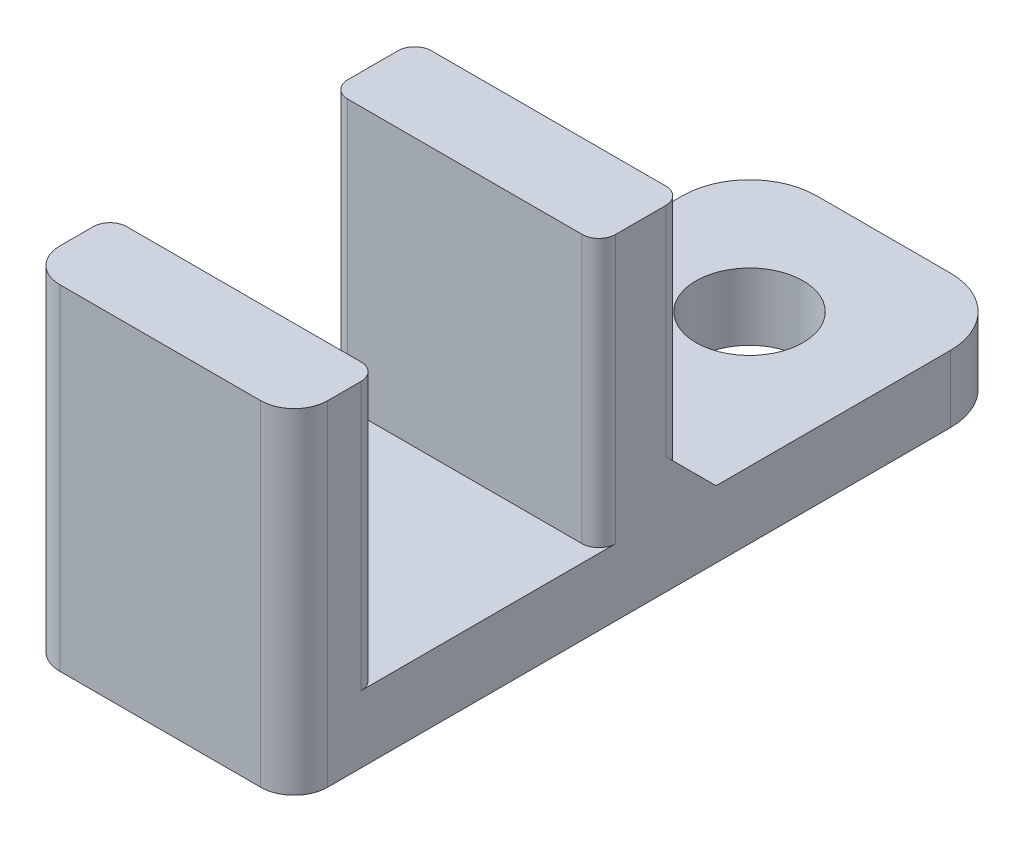
from build123d import *

# Parameters (mm, degrees)
ESBO_O1_W                = 8
ESBO_O1_H                = 21.6
RESSALTO_EXTRUS_O1_DEPTH = 2
ESBO_O2_W                = 8
ESBO_O2_H                = 2.5
RESSALTO_EXTRUS_O2_DEPTH = 8
ESBO_O3_R                = 1.6
CORTE_EXTRUS_O1_DEPTH    = 8
FILETE1_R                = 2
FILETE2_R                = 2
FILETE3_R                = 1
FILETE4_R                = 1
CHANFRO1_SIZE            = 1
FILETE5_R                = 0.5
FILETE6_R                = 0.5
FILETE7_R                = 0.5
FILETE8_R                = 0.5
FILETE9_R                = 0.5
FILETE10_R               = 0.5


with BuildPart() as part:
    # Esboço1 → Ressalto-extrusão1 (new body)
    with BuildSketch(Plane(origin=(0, 0, 0), x_dir=(1, 0, 0), z_dir=(0, 1, 0))):
        Rectangle(ESBO_O1_W, ESBO_O1_H)
    extrude(amount=RESSALTO_EXTRUS_O1_DEPTH)

    # Esboço2 → Ressalto-extrusão2 (add)
    with BuildSketch(Plane(origin=(0, 2, 0), x_dir=(1, 0, 0), z_dir=(0, 1, 0))):
        with Locations((0, -9.55)):
            Rectangle(ESBO_O2_W, ESBO_O2_H)
        with Locations((0, -0.45)):
            Rectangle(ESBO_O2_W, ESBO_O2_H)
    extrude(amount=RESSALTO_EXTRUS_O2_DEPTH)

    # Esboço3 → Corte-extrusão1 (cut)
    with BuildSketch(Plane(origin=(0, 2, 0), x_dir=(1, 0, 0), z_dir=(0, 1, 0))):
        with Locations(Location((0, 6.8, 0), (0, 0, 270))):
            Circle(ESBO_O3_R)
    extrude(amount=-CORTE_EXTRUS_O1_DEPTH, mode=Mode.SUBTRACT)

    # Filete1
    filete1_edges = [part.edges().sort_by_distance(p)[0] for p in [
        (-4, 1, -10.8),
    ]]
    fillet(filete1_edges, radius=FILETE1_R)

    # Filete2
    filete2_edges = [part.edges().sort_by_distance(p)[0] for p in [
        (4, 1, -10.8),
    ]]
    fillet(filete2_edges, radius=FILETE2_R)

    # Filete3
    filete3_edges = [part.edges().sort_by_distance(p)[0] for p in [
        (4, 5, 10.8),
    ]]
    fillet(filete3_edges, radius=FILETE3_R)

    # Filete4
    filete4_edges = [part.edges().sort_by_distance(p)[0] for p in [
        (-4, 5, 10.8),
    ]]
    fillet(filete4_edges, radius=FILETE4_R)

    # Chanfro1
    chanfro1_edges = [part.edges().sort_by_distance(p)[0] for p in [
        (0, 2, -0.8),
    ]]
    chamfer(chanfro1_edges, length=CHANFRO1_SIZE)

    # Filete5
    filete5_edges = [part.edges().sort_by_distance(p)[0] for p in [
        (4, 6.5, -0.8),
    ]]
    fillet(filete5_edges, radius=FILETE5_R)

    # Filete6
    filete6_edges = [part.edges().sort_by_distance(p)[0] for p in [
        (-4, 6.5, -0.8),
    ]]
    fillet(filete6_edges, radius=FILETE6_R)

    # Filete7
    filete7_edges = [part.edges().sort_by_distance(p)[0] for p in [
        (4, 6, 8.3),
    ]]
    fillet(filete7_edges, radius=FILETE7_R)

    # Filete8
    filete8_edges = [part.edges().sort_by_distance(p)[0] for p in [
        (-4, 6, 8.3),
    ]]
    fillet(filete8_edges, radius=FILETE8_R)

    # Filete9
    filete9_edges = [part.edges().sort_by_distance(p)[0] for p in [
        (-4, 6, 1.7),
    ]]
    fillet(filete9_edges, radius=FILETE9_R)

    # Filete10
    filete10_edges = [part.edges().sort_by_distance(p)[0] for p in [
        (4, 6, 1.7),
    ]]
    fillet(filete10_edges, radius=FILETE10_R)


solid = part.part
